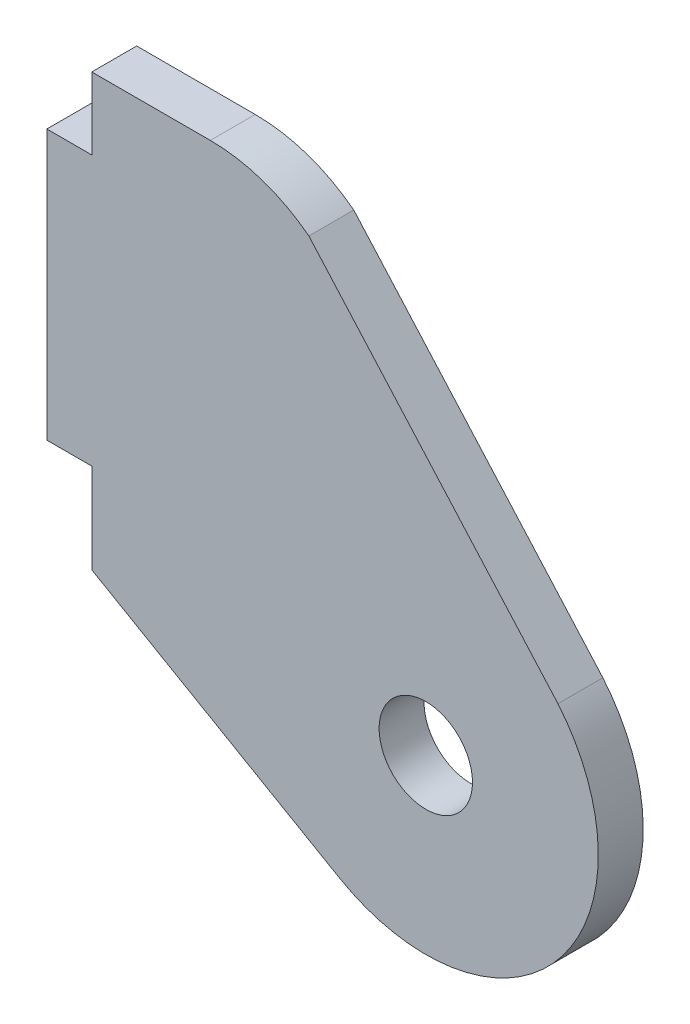
from build123d import *

# Parameters (mm, degrees)
SKETCH1_R           = 3.3
BOSS_EXTRUDE1_DEPTH = 3.175


with BuildPart() as part:
    # Sketch1 → Boss-Extrude1 (new body)
    with BuildSketch(Plane.XY):
        with BuildLine():
            Line((-79.409543338, -48.870574021), (-79.409543338, -29.820574021))
            Line((-79.409543338, -29.820574021), (-76.234543338, -29.820574021))
            Line((-76.234543338, -29.820574021), (-76.234543338, -24.740574021))
            Line((-76.234543338, -24.740574021), (-67.852543338, -24.740574021))
            ThreePointArc((-67.852543338, -24.740574021), (-64.175656813, -25.348124877), (-60.889653149, -27.10618986))
            Line((-60.889653149, -27.10618986), (-43.281292183, -46.938938374))
            ThreePointArc((-43.281292183, -46.938938374), (-43.281292183, -62.612671449), (-58.716906034, -65.334386634))
            Line((-58.716906034, -65.334386634), (-76.234543338, -55.220574021))
            Line((-76.234543338, -55.220574021), (-76.234543338, -48.870574021))
            Line((-76.234543338, -48.870574021), (-79.409543338, -48.870574021))
        make_face()
        with Locations((-52.620906034, -54.775804912)):
            Circle(SKETCH1_R, mode=Mode.SUBTRACT)
    extrude(amount=BOSS_EXTRUDE1_DEPTH)


solid = part.part
